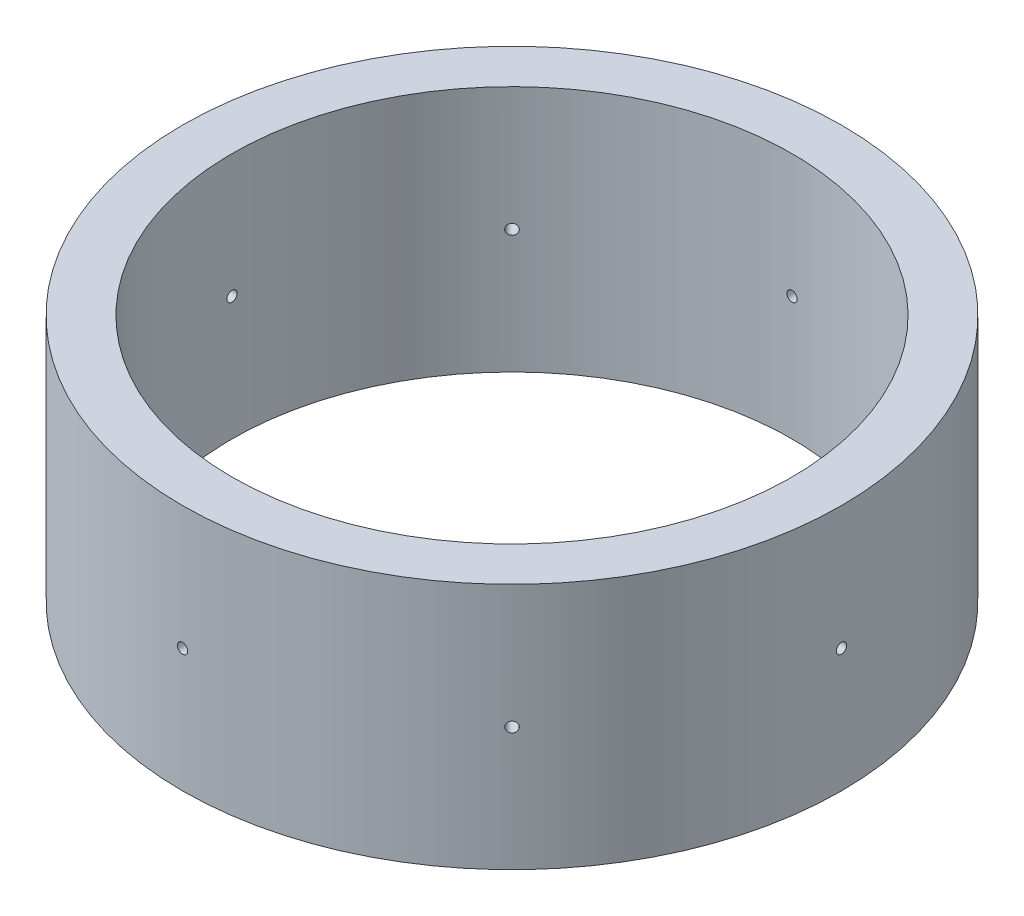
from build123d import *

# Parameters (mm, degrees)
SKETCH1_R               = 101.6
SKETCH1_R_2             = 86.36
BOSS_EXTRUDE1_DEPTH     = 76.2
CUT_EXTRUDE1_REACH      = 241.623
CUT_EXTRUDE1_END_RADIUS = 86.36
SKETCH2_R               = 1.5875
CIRPATTERN1_COUNT       = 8


with BuildPart() as part:
    # Sketch1 → Boss-Extrude1 (new body)
    with BuildSketch(Plane(origin=(0, 0, 0), x_dir=(1, 0, 0), z_dir=(0, 1, 0))):
        with Locations(Location((0, 0, 0), (0, 0, 90))):
            Circle(SKETCH1_R)
        with Locations(Location((0, 0, 0), (0, 0, 90))):
            Circle(SKETCH1_R_2, mode=Mode.SUBTRACT)
    extrude(amount=BOSS_EXTRUDE1_DEPTH)

    # Cut-Extrude1: up to this cylinder (the profile starts outside it)
    cut_extrude1_end = Plane(origin=(0, 38.1, 0), z_dir=(0, -1, 0)) * Cylinder(CUT_EXTRUDE1_END_RADIUS, 656.966, mode=Mode.PRIVATE)
    # Sketch2 → Cut-Extrude1 (cut, up to the surface)
    with BuildSketch(Plane.XY.offset(101.6), mode=Mode.PRIVATE) as cut_extrude1_sk1:
        with Locations((0, 38.1)):
            Circle(SKETCH2_R)
    cut_extrude1_tool1 = extrude(cut_extrude1_sk1.sketch, amount=-CUT_EXTRUDE1_REACH, mode=Mode.PRIVATE) - cut_extrude1_end
    cut_extrude1 = cut_extrude1_tool1.solids().sort_by_distance((0, 38.1, 101.6))[0]
    add(cut_extrude1, mode=Mode.SUBTRACT)

    # CirPattern1: Cut-Extrude1 ×8 about axis
    cirpattern1_axis = Axis((0, 76.2, 0), (0, -1, 0))
    for i in range(1, CIRPATTERN1_COUNT):
        add(cut_extrude1.rotate(cirpattern1_axis, i * 360 / CIRPATTERN1_COUNT), mode=Mode.SUBTRACT)


solid = part.part
